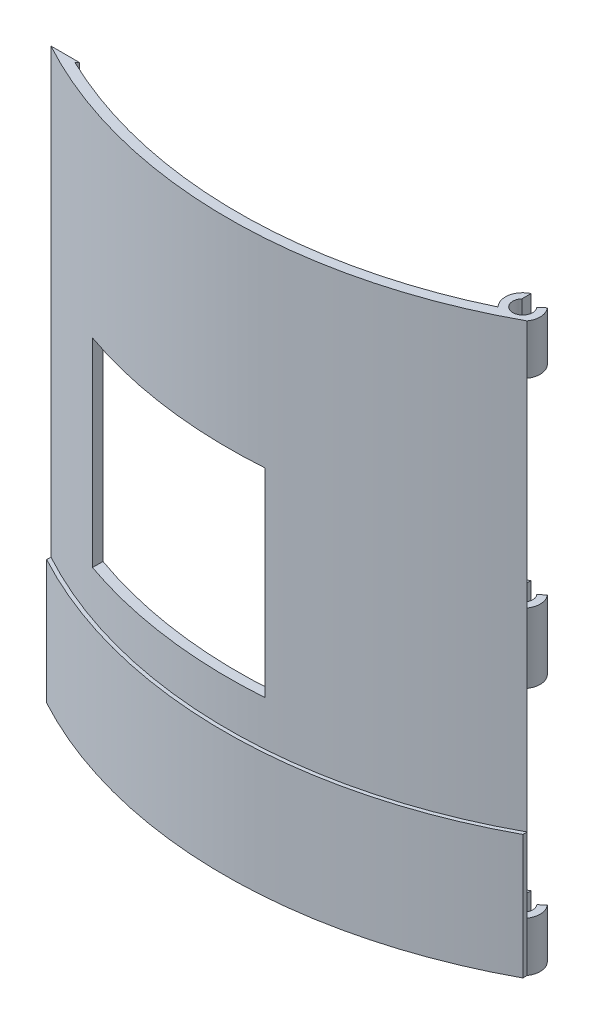
from build123d import *

# Parameters (mm, degrees)
EXTRUDE_1_DEPTH     = 114
EXTRUDE_2_DEPTH     = 25
SKETCH_4_W          = 16.237843285
SKETCH_4_H          = 40
SKETCH_4_W_2        = 18.842025699
SKETCH_4_H_2        = 50
SKETCH_4_W_3        = 19.914336105
CUT_EXTRUDE_1_DEPTH = 20
SKETCH_5_W          = 40
SKETCH_5_H          = 40
CUT_EXTRUDE_2_DEPTH = 20


with BuildPart() as part:
    # 草图1 → 凸台-拉伸1 (new body)
    with BuildSketch(Plane(origin=(0, 0, 0), x_dir=(1, 0, 0), z_dir=(0, 1, 0))):
        with BuildLine():
            Line((90.5, 3.322875656), (90.5, 5.16227766))
            ThreePointArc((90.5, 5.16227766), (88.549473904, 2.586404006), (89.539550125, -0.489214015))
            ThreePointArc((89.539550125, -0.489214015), (47, -10.203390265), (4.460449875, -0.489214015))
            ThreePointArc((4.460449875, -0.489214015), (5.450526096, 2.586404006), (3.5, 5.16227766))
            Line((3.5, 5.16227766), (3.5, 3.322875656))
            ThreePointArc((3.5, 3.322875656), (2, 0), (0.5, 3.322875656))
            Line((0.5, 3.322875656), (0.5, 5.16227766))
            ThreePointArc((0.5, 5.16227766), (-1.382526963, 2.89917259), (-0.872281323, 0))
            ThreePointArc((-0.872281323, 0), (47, -12.203390265), (94.872281323, 0))
            ThreePointArc((94.872281323, 0), (95.494266967, 2.200245764), (94.625, 4.315032397))
            Line((94.625, 4.315032397), (93.5, 3.322875656))
            ThreePointArc((93.5, 3.322875656), (92, 0), (90.5, 3.322875656))
        make_face()
    extrude(amount=EXTRUDE_1_DEPTH)

    # 草图3 → 凸台-拉伸2 (add)
    with BuildSketch(Plane.XZ):
        with BuildLine():
            Line((-0.872281323, 0), (-0.872281323, 0.853303863))
            ThreePointArc((-0.872281323, 0.853303863), (47, 12.953390265), (94.872281323, 0.853303863))
            Line((94.872281323, 0.853303863), (94.872281323, 0))
            ThreePointArc((94.872281323, 0), (47, 12.203390265), (-0.872281323, 0))
        make_face()
    extrude(amount=-EXTRUDE_2_DEPTH)

    # 草图4 → 切除-拉伸1 (cut)
    with BuildSketch(Plane.XY):
        with Locations((92.649785841, 84)):
            Rectangle(SKETCH_4_W, SKETCH_4_H)
        with Locations((92.649785841, 30)):
            Rectangle(SKETCH_4_W, SKETCH_4_H)
        with Locations((0.967246157, 89)):
            Rectangle(SKETCH_4_W_2, SKETCH_4_H_2)
        with Locations((1.50340136, 25)):
            Rectangle(SKETCH_4_W_3, SKETCH_4_H_2)
    extrude(amount=-CUT_EXTRUDE_1_DEPTH, mode=Mode.SUBTRACT)

    # 草图5 → 切除-拉伸2 (cut)
    with BuildSketch(Plane.XY):
        with Locations((34.127718677, 54)):
            Rectangle(SKETCH_5_W, SKETCH_5_H)
    extrude(amount=CUT_EXTRUDE_2_DEPTH, mode=Mode.SUBTRACT)


solid = part.part
